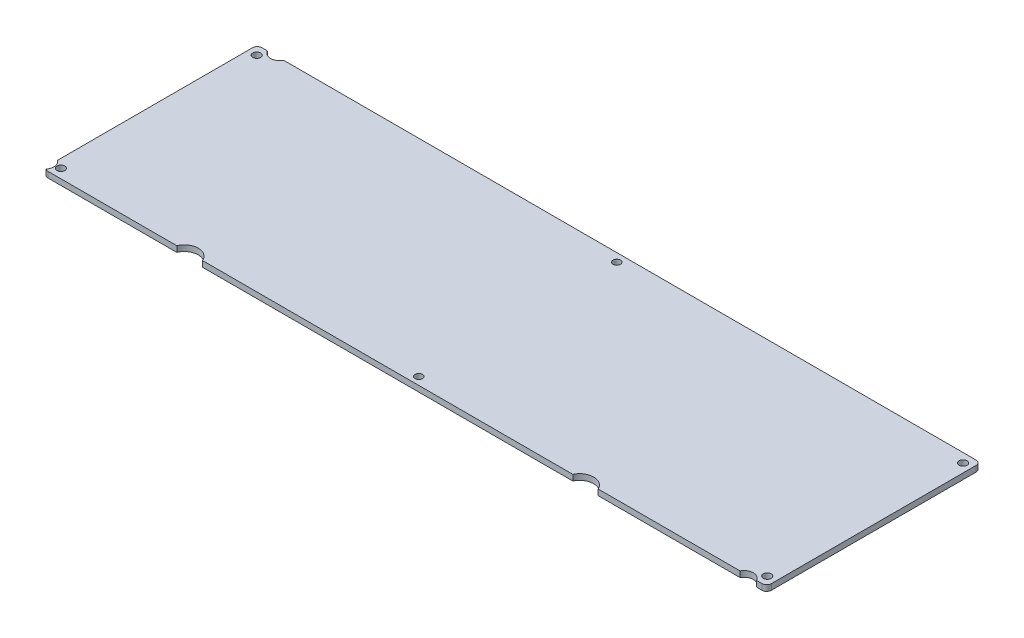
from build123d import *

# Parameters (mm, degrees)
SKETCH_1_R          = 1.7
SKETCH_1_R_2        = 1.6
EXTRUDE_1_DEPTH     = 2.5
FILLET_1_R          = 2
SKETCH_2_R          = 4
CUT_EXTRUDE_1_DEPTH = 325.332005821
SKETCH_3_R          = 6
CUT_EXTRUDE_2_DEPTH = 325.332005821


with BuildPart() as part:
    # 草图1 → 凸台-拉伸1 (new body)
    with BuildSketch(Plane(origin=(0, 0, 0), x_dir=(1, 0, 0), z_dir=(0, 1, 0))):
        with BuildLine():
            Line((0, 92), (4.370919133, 92))
            ThreePointArc((4.370919133, 92), (7.92, 89.845), (11.469080867, 92))
            Line((11.469080867, 92), (311, 92))
            Line((311, 92), (311, 0))
            Line((311, 0), (306.629080867, 0))
            ThreePointArc((306.629080867, 0), (303.08, 2.155), (299.530919133, 0))
            Line((299.530919133, 0), (0, 0))
            Line((0, 0), (0, 92))
        make_face()
        with Locations((3.68, 88.095)):
            Circle(SKETCH_1_R, mode=Mode.SUBTRACT)
        with Locations((307.32, 88.095)):
            Circle(SKETCH_1_R, mode=Mode.SUBTRACT)
        with Locations((307.32, 3.905)):
            Circle(SKETCH_1_R, mode=Mode.SUBTRACT)
        with Locations((3.68, 3.905)):
            Circle(SKETCH_1_R, mode=Mode.SUBTRACT)
        with Locations((158.14, 88.415)):
            Circle(SKETCH_1_R_2, mode=Mode.SUBTRACT)
        with Locations((158.14, 3.315)):
            Circle(SKETCH_1_R_2, mode=Mode.SUBTRACT)
    extrude(amount=EXTRUDE_1_DEPTH)

    # 圆角1
    fillet_1_edges = [part.edges().sort_by_distance(p)[0] for p in [
        (311, 1.25, -92),
        (0, 1.25, 0),
        (0, 1.25, -92),
        (311, 1.25, 0),
    ]]
    fillet(fillet_1_edges, radius=FILLET_1_R)

    # 草图2 → 切除-拉伸1 (cut, through all)
    with BuildSketch(Plane(origin=(0, 2.5, 0), x_dir=(1, 0, 0), z_dir=(0, 1, 0))):
        with Locations((-2.32, 2.905)):
            Circle(SKETCH_2_R)
    extrude(amount=-CUT_EXTRUDE_1_DEPTH, mode=Mode.SUBTRACT)

    # 草图3 → 切除-拉伸2 (cut, through all)
    with BuildSketch(Plane(origin=(0, 2.5, 0), x_dir=(1, 0, 0), z_dir=(0, 1, 0))):
        with Locations((233.122222663, -2.505770404)):
            Circle(SKETCH_3_R)
        with Locations((62.9423368, -2.308672799)):
            Circle(SKETCH_3_R)
    extrude(amount=-CUT_EXTRUDE_2_DEPTH, mode=Mode.SUBTRACT)


solid = part.part
